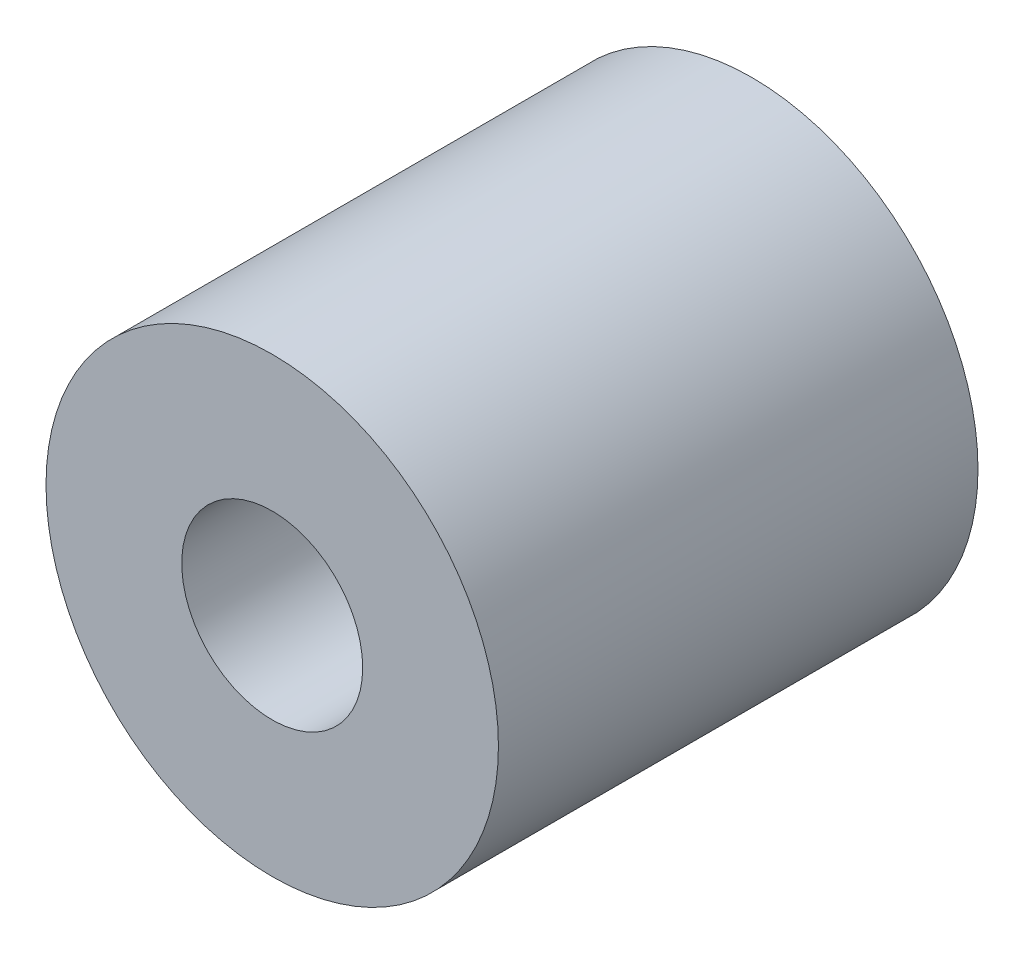
from build123d import *

# Parameters (mm, degrees)
SKETCH1_R           = 7.5
BOSS_EXTRUDE1_DEPTH = 15.9
SKETCH2_R           = 3
CUT_EXTRUDE1_DEPTH  = 7.5
CUT_EXTRUDE2_START  = -7.5
SKETCH4_R           = 3
CUT_EXTRUDE2_DEPTH  = 7.5


with BuildPart() as part:
    # Sketch1 → Boss-Extrude1 (new body)
    with BuildSketch(Plane.XY):
        Circle(SKETCH1_R)
    extrude(amount=BOSS_EXTRUDE1_DEPTH)

    # Sketch2 → Cut-Extrude1 (cut)
    with BuildSketch(Plane.XY.offset(15.9)):
        Circle(SKETCH2_R)
    extrude(amount=-CUT_EXTRUDE1_DEPTH, mode=Mode.SUBTRACT)

    # Sketch4 → Cut-Extrude2 (cut)
    with BuildSketch(Plane(origin=(0, 0, 0), x_dir=(-1, 0, 0), z_dir=(0, 0, -1)).offset(CUT_EXTRUDE2_START)):
        with Locations(Location((0, 0, 0), (0, 0, 180))):
            Circle(SKETCH4_R)
    extrude(amount=CUT_EXTRUDE2_DEPTH, mode=Mode.SUBTRACT)


solid = part.part
